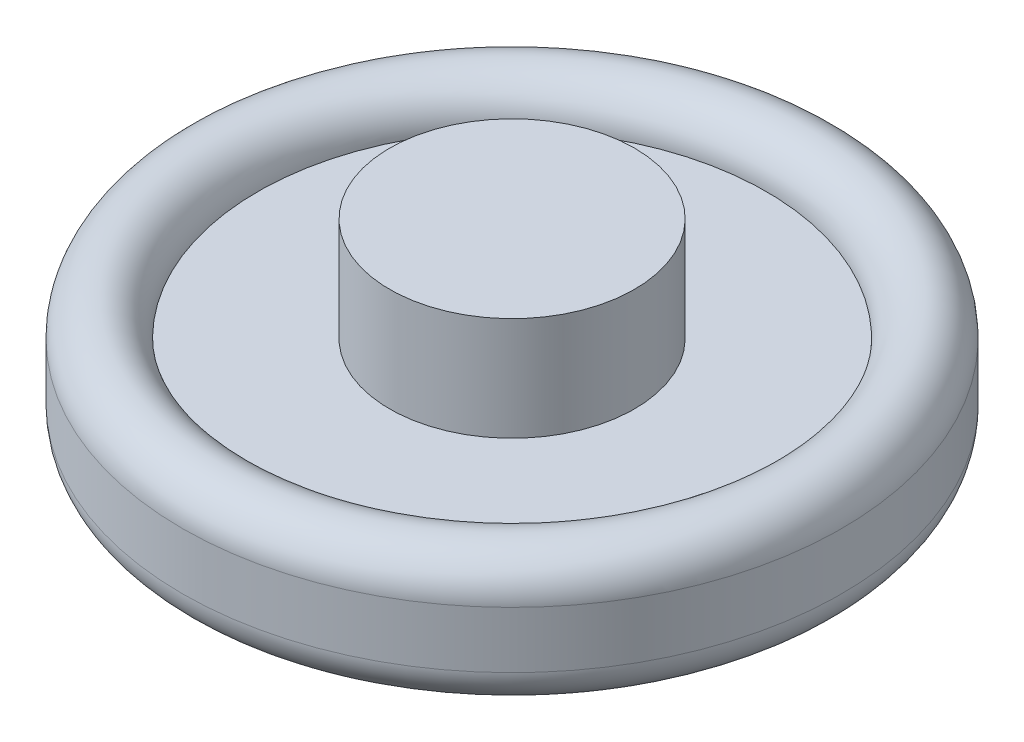
from build123d import *

# Parameters (mm, degrees)
SKETCH_1_W          = 13.5
SKETCH_1_H          = 3
SKETCH_4_R          = 6.5
EXTRUDE_1_DEPTH     = 7
CUT_EXTRUDE_1_DEPTH = 1.5
CUT_EXTRUDE_START   = 3.5
CUT_EXTRUDE_2_DEPTH = 1.5
CUT_EXTRUDE_3_REACH = 28.168
SKETCH_6_R          = 3


with BuildPart() as part:
    # Эскиз1 → Повернуть1 (revolve)
    with BuildSketch(Plane.XY, mode=Mode.PRIVATE) as revolve_1_sk:
        with BuildLine():
            Line((17.5, -1.5), (17.5, 1.5))
            ThreePointArc((17.5, 1.5), (15.5, 3.5), (13.5, 1.5))
            Line((13.5, 1.5), (13.5, -1.5))
            ThreePointArc((13.5, -1.5), (15.5, -3.5), (17.5, -1.5))
        make_face()
        with Locations((6.75, 0)):
            Rectangle(SKETCH_1_W, SKETCH_1_H)
    revolve(revolve_1_sk.sketch.rotate(Axis((0, 0, 0), (0, -1, 0)), 90), axis=Axis((0, 0, 0), (0, -1, 0)))

    # Эскиз4 → Бобышка-Вытянуть1 (add)
    with BuildSketch(Plane(origin=(0, 0, 0), x_dir=(1, 0, 0), z_dir=(0, 1, 0))):
        with Locations(Location((0, 0, 0), (0, 0, 270))):
            Circle(SKETCH_4_R)
    extrude(amount=EXTRUDE_1_DEPTH)

    # Эскиз5 → Вырез-Вытянуть1 (cut)
    with BuildSketch(Plane(origin=(0, 4.75, 0), x_dir=(-1, 0, 0), z_dir=(0, -1, 0))):
        Polygon((2.309401077, 4), (-2.309401077, 4), (-4.618802154, 0), (-2.309401077, -4), (2.309401077, -4), (4.618802154, 0), align=None)
    extrude(amount=CUT_EXTRUDE_1_DEPTH, mode=Mode.SUBTRACT)

    # Эскиз5<2> → Вырез-Вытянуть2 (cut)
    with BuildSketch(Plane(origin=(0, 4.75, 0), x_dir=(-1, 0, 0), z_dir=(0, -1, 0)).offset(CUT_EXTRUDE_START)):
        Polygon((2.309401077, 4), (-2.309401077, 4), (-4.618802154, 0), (-2.309401077, -4), (2.309401077, -4), (4.618802154, 0), align=None)
    extrude(amount=CUT_EXTRUDE_2_DEPTH, mode=Mode.SUBTRACT)

    # Вырез-Вытянуть3: up to this face of the body (flat: up to its plane)
    cut_extrude_3_end = Plane(part.part.faces().sort_by_distance((0, 4.75, 0))[0])
    # Эскиз6 → Вырез-Вытянуть3 (cut, up to the picked face)
    with BuildSketch(Plane.XZ.offset(1.5), mode=Mode.PRIVATE) as cut_extrude_3_sk1:
        with Locations(Location((0, 0, 0), (0, 0, 270))):
            Circle(SKETCH_6_R)
    cut_extrude_3_tool1 = split(extrude(cut_extrude_3_sk1.sketch, amount=-CUT_EXTRUDE_3_REACH, mode=Mode.PRIVATE), bisect_by=cut_extrude_3_end, keep=Keep.BOTH, mode=Mode.PRIVATE)
    add(cut_extrude_3_tool1.solids().sort_by(Axis((0, -1.5, 0), (0, 1, 0)))[0], mode=Mode.SUBTRACT)


solid = part.part
